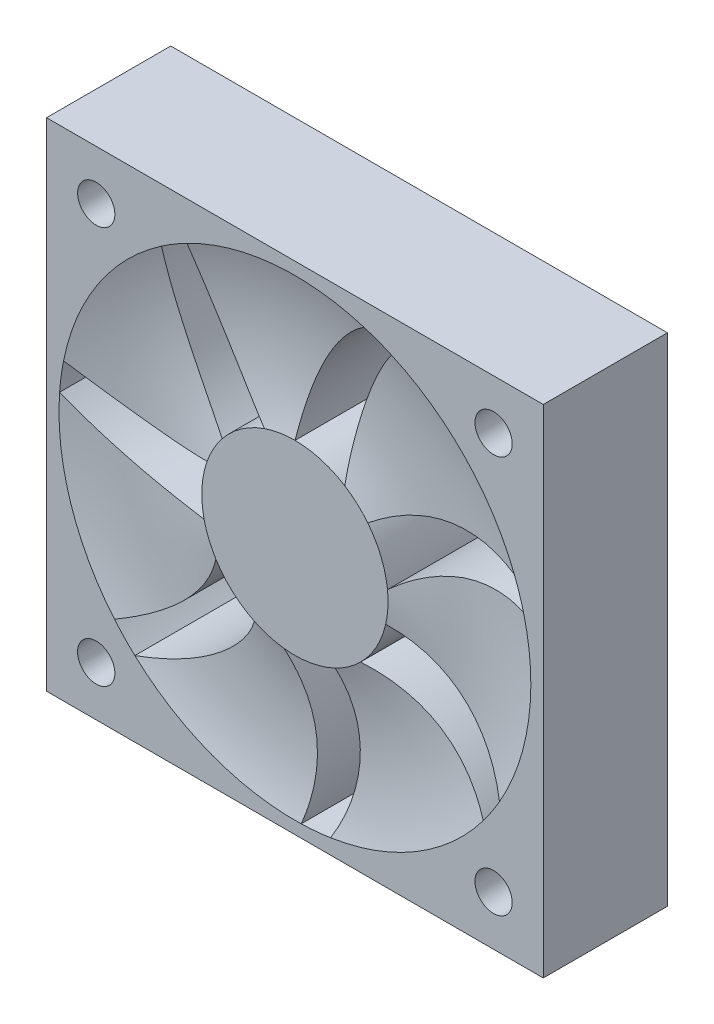
from build123d import *

# Parameters (mm, degrees)
ESQUISSE1_W                  = 40
ESQUISSE1_H                  = 40
ESQUISSE1_R                  = 1.5
BOSS_EXTRU_1_DEPTH           = 10
ENL_V_MAT_EXTRU_1_DEPTH      = 31
R_P_TITION_CIRCULAIRE1_COUNT = 7


with BuildPart() as part:
    # Esquisse1 → Boss.-Extru.1 (new body)
    with BuildSketch(Plane.XY):
        Rectangle(ESQUISSE1_W, ESQUISSE1_H)
        with Locations((-16, 16)):
            Circle(ESQUISSE1_R, mode=Mode.SUBTRACT)
        with Locations(Location((16, 16, 0), (0, 0, 180))):
            Circle(ESQUISSE1_R, mode=Mode.SUBTRACT)
        with Locations((16, -16)):
            Circle(ESQUISSE1_R, mode=Mode.SUBTRACT)
        with Locations(Location((-16, -16, 0), (0, 0, 180))):
            Circle(ESQUISSE1_R, mode=Mode.SUBTRACT)
    extrude(amount=BOSS_EXTRU_1_DEPTH)

    # Esquisse2 → Enlèv. mat.-Extru.1 (cut, through all)
    with BuildSketch(Plane.XY.offset(10)):
        with BuildLine():
            ThreePointArc((4.013801979, 6.335565774), (2.093936315, 7.201765805), (0.00893123, 7.499994682))
            ThreePointArc((0.00893123, 7.499994682), (1.579824901, 13.460592117), (5.558485397, 18.168743492))
            ThreePointArc((5.558485397, 18.168743492), (6.684148303, 17.785448026), (7.783629485, 17.332487186))
            ThreePointArc((7.783629485, 17.332487186), (4.864634522, 12.188517309), (4.013801979, 6.335565774))
        make_face()
    enl_v_mat_extru_1 = extrude(amount=-ENL_V_MAT_EXTRU_1_DEPTH, mode=Mode.SUBTRACT)

    # Répétition circulaire1: Enlèv. mat.-Extru.1 ×7 about axis
    r_p_tition_circulaire1_axis = Axis((0, 0, 0), (0, 0, 1))
    for i in range(1, R_P_TITION_CIRCULAIRE1_COUNT):
        add(enl_v_mat_extru_1.rotate(r_p_tition_circulaire1_axis, i * 360 / R_P_TITION_CIRCULAIRE1_COUNT), mode=Mode.SUBTRACT)

    # Esquisse3 → Enlèvement de matière-Révolution1 (revolve, cut)
    with BuildSketch(Plane(origin=(0, 0, 0), x_dir=(0, 0, -1), z_dir=(1, 0, 0))):
        with BuildLine():
            Line((0, 19), (0, 7.5))
            ThreePointArc((0, 7.5), (-0.844387246, 13.25), (0, 19))
        make_face()
        with BuildLine():
            Line((-10, 19), (-10, 7.5))
            ThreePointArc((-10, 7.5), (-9.155612754, 13.25), (-10, 19))
        make_face()
    revolve(axis=Axis((0, 0, -0.5), (0, 0, 1)), mode=Mode.SUBTRACT)


solid = part.part
